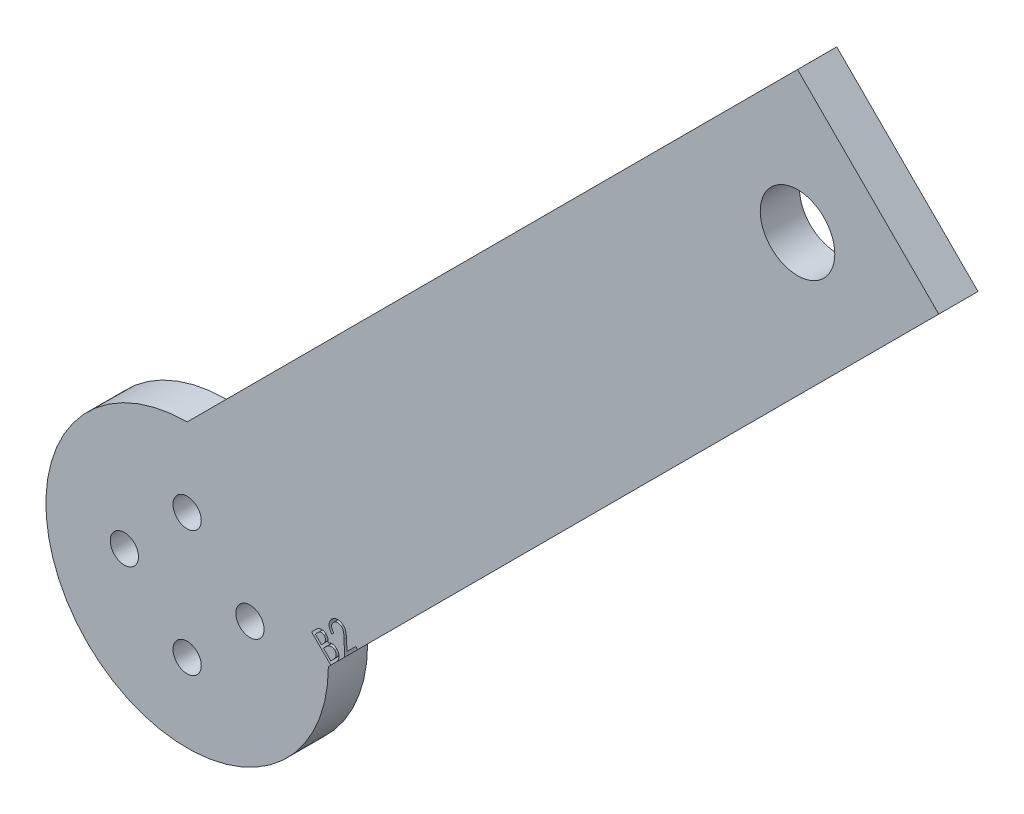
from build123d import *

# Parameters (mm, degrees)
EXTRUDE_1_DEPTH     = 5
SKETCH_3_R          = 1.8
CUT_EXTRUDE_1_DEPTH = 5
SKETCH_17_R         = 4.75
CUT_EXTRUDE_3_DEPTH = 10
CUT_EXTRUDE_4_DEPTH = 2


with BuildPart() as part:
    # ｽｹｯﾁ2 → ﾎﾞｽ - 押し出し1 (new body)
    with BuildSketch(Plane.XY):
        with BuildLine():
            Line((0, 18), (77.781745931, 95.781745931))
            Line((77.781745931, 95.781745931), (95.781745931, 77.781745931))
            Line((95.781745931, 77.781745931), (18, 0))
            ThreePointArc((18, 0), (-12.727922061, -12.727922061), (0, 18))
        make_face()
    extrude(amount=EXTRUDE_1_DEPTH)

    # ｽｹｯﾁ3 → ｶｯﾄ - 押し出し1 (cut)
    with BuildSketch(Plane.XY.offset(5)):
        with Locations((8, 0)):
            Circle(SKETCH_3_R)
        with Locations((-8, 0)):
            Circle(SKETCH_3_R)
        with Locations((0, 8)):
            Circle(SKETCH_3_R)
        with Locations((0, -8)):
            Circle(SKETCH_3_R)
    extrude(amount=-CUT_EXTRUDE_1_DEPTH, mode=Mode.SUBTRACT)

    # ｽｹｯﾁ17 → ｶｯﾄ - 押し出し3 (cut)
    with BuildSketch(Plane(origin=(0, 0, 0), x_dir=(-1, 0, 0), z_dir=(0, 0, -1))):
        with Locations((-77.781745931, 77.781745931)):
            Circle(SKETCH_17_R)
    extrude(amount=-CUT_EXTRUDE_3_DEPTH, mode=Mode.SUBTRACT)

    # ｽｹｯﾁ19 → ｶｯﾄ - 押し出し4 (cut)
    # profile 1 of 2: a face of its own
    with BuildSketch(Plane.XY.offset(5)):
        with BuildLine():
            Line((15.855268429, 2.754707532), (16.337640224, 3.237079327))
            add(Edge.make_bspline(
                [(16.337640224, 3.237079327), (16.361636244, 3.260293397), (16.408218349, 3.305357545), (16.477274438, 3.369688106), (16.545469784, 3.426369048), (16.611269245, 3.476782595), (16.67453774, 3.521568948), (16.7361987, 3.559379809), (16.795825225, 3.591200716), (16.871872864, 3.624727999), (16.966969698, 3.653873017), (17.082479968, 3.672190677), (17.199066441, 3.670898236), (17.315110423, 3.653286605), (17.428379125, 3.620047404), (17.535289182, 3.570326931), (17.635068442, 3.505394709), (17.693419935, 3.451135959), (17.723056891, 3.423577724)],
                knots=[0, 0, 0, 0, 1.010039783, 1.960732594, 2.854180912, 3.691307208, 4.468005985, 5.197960132, 5.877927144, 6.511073573, 7.709718577, 8.875597696, 10.035092746, 11.221940952, 12.416492297, 13.593189445, 14.77757135, 16, 16, 16, 16], degree=3))
            add(Edge.make_bspline(
                [(17.723056891, 3.423577724), (17.748907222, 3.395988049), (17.799791951, 3.341679529), (17.86086192, 3.249034468), (17.909264362, 3.150974335), (17.943058942, 3.046588677), (17.961703364, 2.937773062), (17.966408423, 2.825238629), (17.953357726, 2.709867118), (17.933631581, 2.633681441), (17.923577724, 2.594851763)],
                knots=[0, 0, 0, 0, 1.009361854, 1.986864539, 2.953844043, 3.926119456, 4.909298338, 5.897350454, 6.928339162, 8, 8, 8, 8], degree=3))
            add(Edge.make_bspline(
                [(17.923577724, 2.594851763), (17.964691882, 2.614115345), (18.043041439, 2.65082516), (18.158995384, 2.694482079), (18.267164276, 2.722716641), (18.368266928, 2.738437175), (18.464712365, 2.740724318), (18.559105414, 2.734343145), (18.652074716, 2.715438953), (18.743271203, 2.687478622), (18.832032435, 2.649809029), (18.91600667, 2.600887503), (18.996554039, 2.543324189), (19.044720198, 2.497538819), (19.069210737, 2.474258814)],
                knots=[0, 0, 0, 0, 1.315874709, 2.507608225, 3.585498209, 4.551237979, 5.466196096, 6.376502642, 7.28791766, 8.209348528, 9.138022758, 10.075770395, 11.021607253, 12, 12, 12, 12], degree=3))
            add(Edge.make_bspline(
                [(19.069210737, 2.474258814), (19.092599473, 2.449440468), (19.138665609, 2.400558591), (19.198580808, 2.320813485), (19.248757659, 2.23696628), (19.288874035, 2.148973724), (19.319088088, 2.056988851), (19.340337711, 1.961420498), (19.35116162, 1.861779131), (19.353603595, 1.759420479), (19.344959283, 1.655856432), (19.326582306, 1.552865819), (19.294576433, 1.45235159), (19.254469783, 1.352640057), (19.20080809, 1.255845024), (19.137696991, 1.160117323), (19.062923216, 1.06637518), (19.006366272, 1.0075364), (18.977363782, 0.977363782)],
                knots=[0, 0, 0, 0, 0.973618807, 1.917626368, 2.842748053, 3.759934448, 4.674078596, 5.603861842, 6.551239227, 7.532836595, 8.524148287, 9.515392535, 10.514251514, 11.532117037, 12.580696629, 13.669460725, 14.804895817, 16, 16, 16, 16], degree=3))
            Line((18.977363782, 0.977363782), (18.304987981, 0.304987981))
            Line((18.304987981, 0.304987981), (15.855268429, 2.754707532))
        make_face()
        with BuildLine():
            Line((16.334835737, 2.754707532), (17.119391026, 1.970152244))
            Line((17.119391026, 1.970152244), (17.258914263, 2.109675481))
            add(Edge.make_bspline(
                [(17.258914263, 2.109675481), (17.279344867, 2.130379618), (17.318824587, 2.170387907), (17.374290472, 2.229756369), (17.423622628, 2.287023454), (17.46759557, 2.341089529), (17.505709798, 2.392568092), (17.538391302, 2.441009596), (17.564858174, 2.487055997), (17.59309413, 2.543941625), (17.61852077, 2.614305549), (17.634551731, 2.700009307), (17.638401776, 2.786264897), (17.628385667, 2.872059035), (17.606163371, 2.955255632), (17.571896096, 3.033288034), (17.527167166, 3.106177436), (17.488243893, 3.147939793), (17.468549679, 3.169070513)],
                knots=[0, 0, 0, 0, 1.139072835, 2.201123148, 3.180922261, 4.098564989, 4.929603435, 5.688574638, 6.38558588, 7.007733967, 8.174379991, 9.301625663, 10.40998766, 11.542977531, 12.670780372, 13.769197616, 14.871269156, 16, 16, 16, 16], degree=3))
            add(Edge.make_bspline(
                [(17.468549679, 3.169070513), (17.454575514, 3.182486455), (17.427337097, 3.208636784), (17.382583156, 3.241568237), (17.337070195, 3.26937696), (17.289599855, 3.290450484), (17.240941161, 3.305995855), (17.190869145, 3.316038947), (17.139270655, 3.319472649), (17.086335591, 3.316518886), (17.031949874, 3.307352849), (16.976158216, 3.290996189), (16.919247017, 3.26700645), (16.861553932, 3.234663866), (16.802018981, 3.196097992), (16.740847938, 3.150508239), (16.679193241, 3.096629559), (16.63849147, 3.057531664), (16.617387821, 3.037259615)],
                knots=[0, 0, 0, 0, 0.948557859, 1.848927212, 2.71724673, 3.558159299, 4.387760741, 5.216729262, 6.05490664, 6.915255925, 7.809776763, 8.752297874, 9.758582881, 10.830042875, 11.989777664, 13.233797524, 14.565738862, 16, 16, 16, 16], degree=3))
            Line((16.617387821, 3.037259615), (16.334835737, 2.754707532))
        make_face(mode=Mode.SUBTRACT)
        with BuildLine():
            Line((17.365484776, 1.724058494), (18.304987981, 0.784555288))
            Line((18.304987981, 0.784555288), (18.607872596, 1.087439904))
            add(Edge.make_bspline(
                [(18.607872596, 1.087439904), (18.629275206, 1.109044591), (18.670816198, 1.150977801), (18.728580676, 1.213637686), (18.78040811, 1.273630721), (18.825520515, 1.331067172), (18.866079219, 1.384610685), (18.899201172, 1.436380235), (18.926601353, 1.484976682), (18.954768318, 1.545783007), (18.979194131, 1.621060865), (18.995742258, 1.712595152), (18.998646701, 1.805475959), (18.987264732, 1.898018549), (18.963346012, 1.987540592), (18.928834252, 2.071841306), (18.880150283, 2.14816153), (18.83991129, 2.192483861), (18.819611378, 2.21484375)],
                knots=[0, 0, 0, 0, 1.124283346, 2.182156578, 3.150297016, 4.054434607, 4.882226797, 5.63242387, 6.324810436, 6.943388099, 8.107411426, 9.239635659, 10.372090665, 11.529585415, 12.673943896, 13.789259634, 14.884717733, 16, 16, 16, 16], degree=3))
            add(Edge.make_bspline(
                [(18.819611378, 2.21484375), (18.805806454, 2.227944224), (18.778702867, 2.253664746), (18.734584284, 2.287729298), (18.688545814, 2.316959056), (18.640393723, 2.34210168), (18.589844066, 2.361232353), (18.537722466, 2.377153327), (18.48338692, 2.387336794), (18.408586834, 2.395986172), (18.312331465, 2.394051135), (18.196455649, 2.371495813), (18.0799591, 2.329788664), (18.006450681, 2.288217522), (17.968449519, 2.266726763)],
                knots=[0, 0, 0, 0, 0.741244022, 1.455304822, 2.167737733, 2.864218412, 3.56774849, 4.270806875, 4.985216026, 5.718360007, 7.203028222, 8.714052242, 10.301285311, 12, 12, 12, 12], degree=3))
            add(Edge.make_bspline(
                [(17.968449519, 2.266726763), (17.954546976, 2.257775345), (17.924760951, 2.238597044), (17.879294179, 2.204076146), (17.827704, 2.164687202), (17.772886789, 2.116183819), (17.711833805, 2.062785945), (17.646541649, 2.002059991), (17.576390559, 1.934775072), (17.528528915, 1.887037845), (17.503605769, 1.862179487)],
                knots=[0, 0, 0, 0, 0.642612026, 1.376788289, 2.218319108, 3.165410458, 4.221040441, 5.371965022, 6.631494974, 8, 8, 8, 8], degree=3))
            Line((17.503605769, 1.862179487), (17.365484776, 1.724058494))
        make_face(mode=Mode.SUBTRACT)
    # profile 2 of 2: a face of its own
    with BuildSketch(Plane.XY.offset(5)):
        with BuildLine():
            Line((18.679947712, 4.043930084), (18.44507191, 3.809054282))
            add(Edge.make_bspline(
                [(18.44507191, 3.809054282), (18.416983932, 3.840170168), (18.361794655, 3.901308896), (18.289058706, 3.998984644), (18.228914661, 4.100448905), (18.178478634, 4.204177565), (18.138903344, 4.310656829), (18.111651343, 4.420543131), (18.094547862, 4.532976572), (18.08939992, 4.647347725), (18.093832951, 4.761245325), (18.110110402, 4.872329147), (18.13687007, 4.97967582), (18.174154567, 5.083059235), (18.22195057, 5.182683742), (18.281669605, 5.277557742), (18.351059086, 5.369391845), (18.40454396, 5.425861966), (18.431750596, 5.454587135)],
                knots=[0, 0, 0, 0, 1.097080493, 2.155622548, 3.181877021, 4.180734131, 5.171877943, 6.149826956, 7.139761318, 8.144411119, 9.14266836, 10.119602376, 11.078258423, 12.0343727, 12.992188754, 13.965052194, 14.964864601, 16, 16, 16, 16], degree=3))
            add(Edge.make_bspline(
                [(18.431750596, 5.454587135), (18.459728021, 5.481612676), (18.514591686, 5.534609697), (18.60439323, 5.60211944), (18.69571669, 5.660794713), (18.790830929, 5.706755278), (18.888070431, 5.743267195), (18.988603955, 5.767688853), (19.091741846, 5.781938676), (19.196790844, 5.784293399), (19.300677998, 5.777248543), (19.401891161, 5.761999775), (19.498923643, 5.737464105), (19.591941986, 5.703655765), (19.68082881, 5.660760647), (19.76507071, 5.608128396), (19.846475316, 5.54838448), (19.895482733, 5.501434536), (19.920232167, 5.477724154)],
                knots=[0, 0, 0, 0, 1.122280858, 2.200790098, 3.238096709, 4.252246287, 5.245154776, 6.232174131, 7.233396592, 8.24608549, 9.260661639, 10.237102996, 11.197933074, 12.145853668, 13.090621777, 14.04209139, 15.011228647, 16, 16, 16, 16], degree=3))
            add(Edge.make_bspline(
                [(19.920232167, 5.477724154), (19.953205475, 5.442293204), (20.018629785, 5.371992539), (20.09966903, 5.252732607), (20.164376509, 5.124122072), (20.205880126, 5.008848802), (20.231239822, 4.908550418), (20.249715247, 4.823271807), (20.265524198, 4.728013737), (20.27929129, 4.62250671), (20.291933535, 4.50728391), (20.302380902, 4.381974197), (20.310575865, 4.246840451), (20.314853989, 4.153311221), (20.317067103, 4.10492768)],
                knots=[0, 0, 0, 0, 1.186965879, 2.35512989, 3.525250991, 4.714032238, 5.354204103, 6.064327219, 6.855751055, 7.724040526, 8.676397383, 9.701349061, 10.810886467, 12, 12, 12, 12], degree=3))
            Line((20.317067103, 4.10492768), (20.365444507, 2.838000596))
            Line((20.365444507, 2.838000596), (21.496353962, 3.968910052))
            Line((21.496353962, 3.968910052), (21.732632007, 3.732632007))
            Line((21.732632007, 3.732632007), (20.068869987, 2.068869987))
            Line((20.068869987, 2.068869987), (19.993849955, 4.015885212))
            add(Edge.make_bspline(
                [(19.993849955, 4.015885212), (19.992113109, 4.063099402), (19.988775932, 4.153816727), (19.981845913, 4.284484443), (19.973222076, 4.403884114), (19.964749579, 4.512454961), (19.953128947, 4.609375237), (19.941882849, 4.695597448), (19.927639247, 4.770335397), (19.908750093, 4.854933545), (19.877317194, 4.949767602), (19.827335645, 5.054202323), (19.764954117, 5.150376664), (19.713321857, 5.205915084), (19.687459731, 5.233733769)],
                knots=[0, 0, 0, 0, 1.321003384, 2.538175354, 3.658322522, 4.668214357, 5.582507175, 6.387418368, 7.098718825, 7.708986377, 8.810374049, 9.883007488, 10.939617852, 12, 12, 12, 12], degree=3))
            add(Edge.make_bspline(
                [(19.687459731, 5.233733769), (19.669993805, 5.250195408), (19.635512833, 5.282693731), (19.579110355, 5.32516917), (19.519249107, 5.359894834), (19.457130299, 5.389422476), (19.391320896, 5.410894414), (19.322801968, 5.426477708), (19.251121754, 5.434623306), (19.177676874, 5.436898115), (19.103780198, 5.431783075), (19.031391478, 5.420882725), (18.961557848, 5.402606679), (18.894606417, 5.376927439), (18.829634922, 5.345354485), (18.767177019, 5.306599591), (18.707107661, 5.260982346), (18.670494509, 5.225705416), (18.65190284, 5.207792263)],
                knots=[0, 0, 0, 0, 0.999378411, 1.972958028, 2.933057605, 3.878232445, 4.832638458, 5.810492443, 6.800723905, 7.833131529, 8.867373731, 9.88218747, 10.878716478, 11.867798623, 12.864898163, 13.883487664, 14.925263348, 16, 16, 16, 16], degree=3))
            add(Edge.make_bspline(
                [(18.65190284, 5.207792263), (18.633288777, 5.188264155), (18.596602814, 5.149776725), (18.548879607, 5.08691605), (18.50826778, 5.021920064), (18.474454696, 4.954532973), (18.449713127, 4.884407267), (18.431128961, 4.812177099), (18.419803995, 4.73748939), (18.416517719, 4.660670549), (18.42048704, 4.582633329), (18.43343244, 4.504709893), (18.453826133, 4.426921553), (18.482851391, 4.349475495), (18.520438561, 4.272340617), (18.565261079, 4.194965979), (18.618937995, 4.118389312), (18.659286015, 4.069146624), (18.679947712, 4.043930084)],
                knots=[0, 0, 0, 0, 0.998669208, 1.968250618, 2.917050639, 3.834571943, 4.754621645, 5.665832379, 6.593829771, 7.547042473, 8.50933136, 9.482769513, 10.467535104, 11.483758791, 12.540754452, 13.64242777, 14.792717932, 16, 16, 16, 16], degree=3))
        make_face()
    extrude(amount=-CUT_EXTRUDE_4_DEPTH, mode=Mode.SUBTRACT)


solid = part.part
